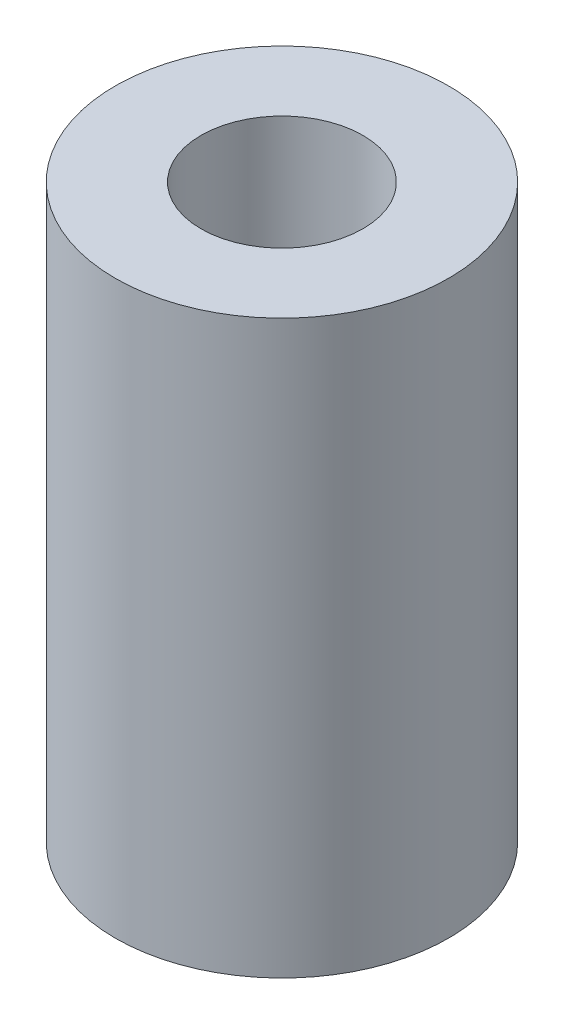
from build123d import *

# Parameters (mm, degrees)
SKETCH1_R           = 3.5
SKETCH1_R_2         = 1.7
BOSS_EXTRUDE1_DEPTH = 12


with BuildPart() as part:
    # Sketch1 → Boss-Extrude1 (new body)
    with BuildSketch(Plane(origin=(0, 0, 0), x_dir=(1, 0, 0), z_dir=(0, 1, 0))):
        with Locations(Location((0, 0, 0), (0, 0, 270))):
            Circle(SKETCH1_R)
        with Locations(Location((0, 0, 0), (0, 0, 270))):
            Circle(SKETCH1_R_2, mode=Mode.SUBTRACT)
    extrude(amount=BOSS_EXTRUDE1_DEPTH)


solid = part.part
